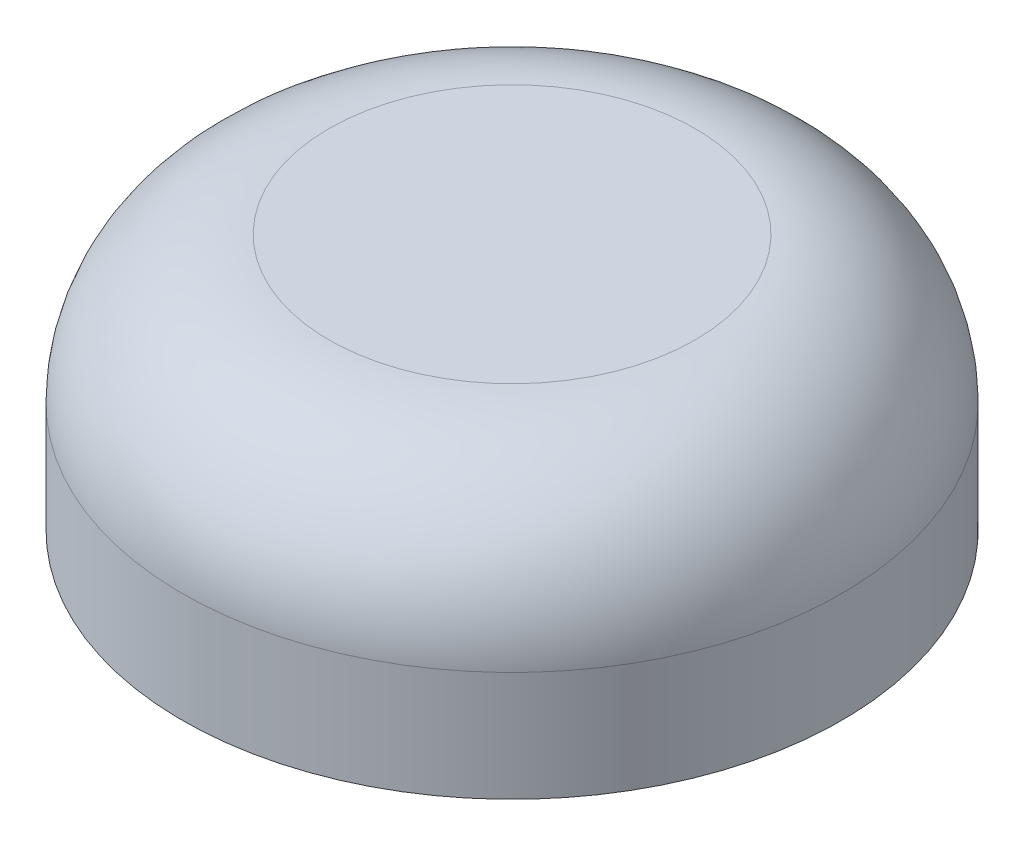
from build123d import *


with BuildPart() as part:
    # Schizzo1 → Rivoluzione1 (revolve)
    with BuildSketch(Plane.XY, mode=Mode.PRIVATE) as rivoluzione1_sk:
        with BuildLine():
            Line((0, 0), (1.5, 0))
            Line((1.5, 0), (1.5, -1.5))
            Line((1.5, -1.5), (4.5, -1.5))
            Line((4.5, -1.5), (4.5, 0))
            ThreePointArc((4.5, 0), (3.914213562, 1.414213562), (2.5, 2))
            Line((2.5, 2), (0, 2))
            Line((0, 2), (0, 0))
        make_face()
    revolve(rivoluzione1_sk.sketch.rotate(Axis((0, 2, 0), (0, -1, 0)), 180), axis=Axis((0, 2, 0), (0, -1, 0)))


solid = part.part
